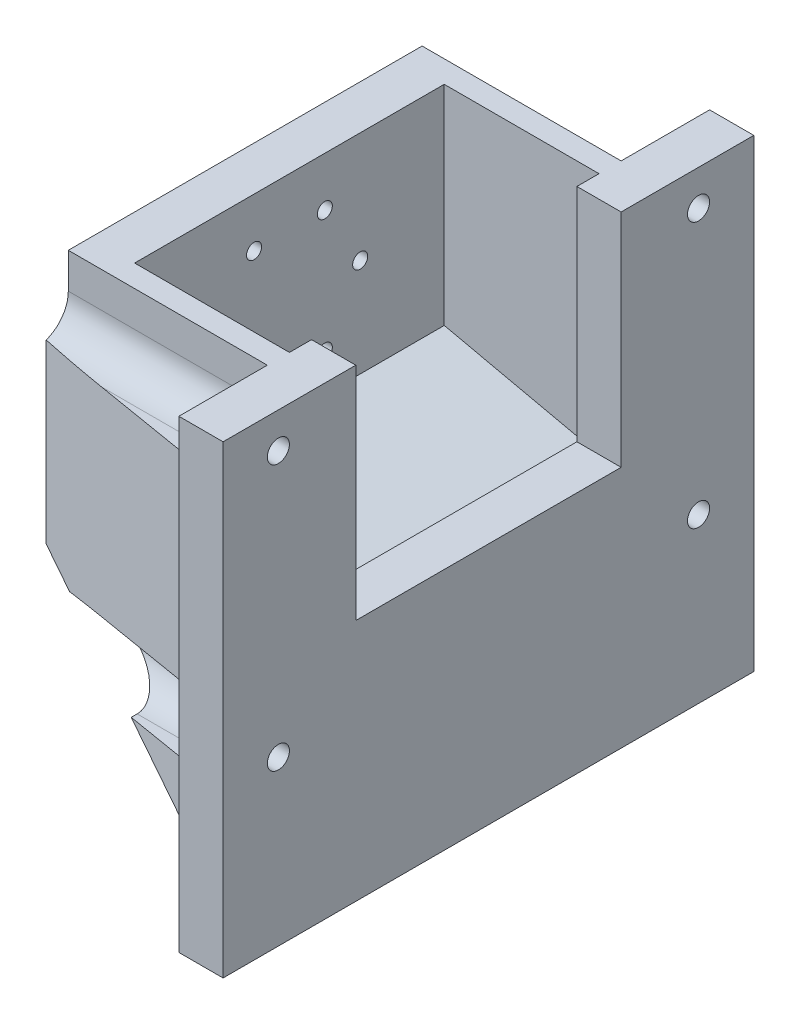
from build123d import *

# Parameters (mm, degrees)
CROQUIS1_R                                           = 2.5
SALIENTE_EXTRUIR1_DEPTH                              = 5
CROQUIS9_W                                           = 90
CROQUIS9_H                                           = 55
SALIENTE_EXTRUIR2_DEPTH                              = 10
REFRENTADO_PARA_TORNILLO_CON_CABEZA_TRON_D           = 3.4
REFRENTADO_PARA_TORNILLO_CON_CABEZA_TRON_DEPTH       = 10
REFRENTADO_PARA_TORNILLO_CON_CABEZA_TRON_CBORE_D     = 7
REFRENTADO_PARA_TORNILLO_CON_CABEZA_TRON_CBORE_DEPTH = 2.4
CORTAR_EXTRUIR1_DEPTH                                = 45


with BuildPart() as part:
    # Croquis1 → Saliente-Extruir1 (new, symmetric)
    with BuildSketch(Plane(origin=(0, 0, 0), x_dir=(0, 0, -1), z_dir=(1, 0, 0))):
        Polygon((-60, 52.5), (-60, -52.5), (60, -52.5), (60, 52.5), (30, 52.5), (30, 2.5), (-30, 2.5), (-30, 52.5), align=None)
        with Locations((-47.5, -15.5)):
            Circle(CROQUIS1_R, mode=Mode.SUBTRACT)
        with Locations((47.5, -15.5)):
            Circle(CROQUIS1_R, mode=Mode.SUBTRACT)
        with Locations((-47.5, 44.5)):
            Circle(CROQUIS1_R, mode=Mode.SUBTRACT)
        with Locations((47.5, 44.5)):
            Circle(CROQUIS1_R, mode=Mode.SUBTRACT)
    extrude(amount=SALIENTE_EXTRUIR1_DEPTH, both=True)

    # Croquis7 → Recubrir3 section 0
    with BuildSketch(Plane.ZY.offset(5)):
        with BuildLine():
            Line((-52.5, -42.5), (52.5, -42.5))
            Line((52.5, -42.5), (52.5, 52.5))
            Line((52.5, 52.5), (35, 52.5))
            Line((35, 52.5), (35, -2.5))
            Line((35, -2.5), (-35, -2.5))
            Line((-35, -2.5), (-35, 52.5))
            Line((-35, 52.5), (-52.5, 52.5))
            Line((-52.5, 52.5), (-52.5, -42.5))
        make_face()
    # Croquis8 → Recubrir3 section 1
    with BuildSketch(Plane(origin=(-50, 0, 0), x_dir=(0, 0, -1), z_dir=(1, 0, 0))):
        with BuildLine():
            Line((-45, -2.5), (45, -2.5))
            Line((45, -2.5), (45, 52.5))
            Line((45, 52.5), (35, 52.5))
            Line((35, 52.5), (35, 7.5))
            Line((35, 7.5), (-35, 7.5))
            Line((-35, 7.5), (-35, 52.5))
            Line((-35, 52.5), (-45, 52.5))
            Line((-45, 52.5), (-45, -2.5))
        make_face()
    loft()

    # Croquis9 → Saliente-Extruir2 (add)
    with BuildSketch(Plane.ZY.offset(50)):
        with Locations((0, 25)):
            Rectangle(CROQUIS9_W, CROQUIS9_H)
    extrude(amount=-SALIENTE_EXTRUIR2_DEPTH)

    # Refrentado para tornillo con cabeza troncocónica de M34
    with Locations(Plane.ZY.offset(50)):
        with Locations((-8, 41.356406461), (8, 41.356406461), (16, 27.5), (8, 13.643593539), (-8, 13.643593539), (-16, 27.5), (-99.109009009, 35.557197268)):
            CounterBoreHole(REFRENTADO_PARA_TORNILLO_CON_CABEZA_TRON_D / 2, REFRENTADO_PARA_TORNILLO_CON_CABEZA_TRON_CBORE_D / 2, REFRENTADO_PARA_TORNILLO_CON_CABEZA_TRON_CBORE_DEPTH, depth=REFRENTADO_PARA_TORNILLO_CON_CABEZA_TRON_DEPTH)

    # Croquis12 → Cortar-Extruir1 (cut)
    with BuildSketch(Plane.ZY.offset(50)):
        with BuildLine():
            Line((-40, 44.5), (-40, 52.5))
            Line((-40, 52.5), (-55, 52.5))
            Line((-55, 52.5), (-55, 44.5))
            Line((-55, 44.5), (-55, 37))
            Line((-55, 37), (-47.5, 37))
            ThreePointArc((-47.5, 37), (-42.196699141, 39.196699141), (-40, 44.5))
        make_face()
        with BuildLine():
            Line((40, 44.5), (40, 52.5))
            Line((40, 52.5), (55, 52.5))
            Line((55, 52.5), (55, 44.5))
            Line((55, 44.5), (55, 37))
            Line((55, 37), (47.5, 37))
            ThreePointArc((47.5, 37), (42.196699141, 39.196699141), (40, 44.5))
        make_face()
        with BuildLine():
            Line((47.5, -8), (55, -8))
            Line((55, -8), (55, -15.5))
            Line((55, -15.5), (55, -23))
            Line((55, -23), (47.5, -23))
            ThreePointArc((47.5, -23), (40, -15.5), (47.5, -8))
        make_face()
        with BuildLine():
            Line((-47.5, -8), (-55, -8))
            Line((-55, -8), (-55, -15.5))
            Line((-55, -15.5), (-55, -23))
            Line((-55, -23), (-47.5, -23))
            ThreePointArc((-47.5, -23), (-40, -15.5), (-47.5, -8))
        make_face()
    extrude(amount=-CORTAR_EXTRUIR1_DEPTH, mode=Mode.SUBTRACT)


solid = part.part
